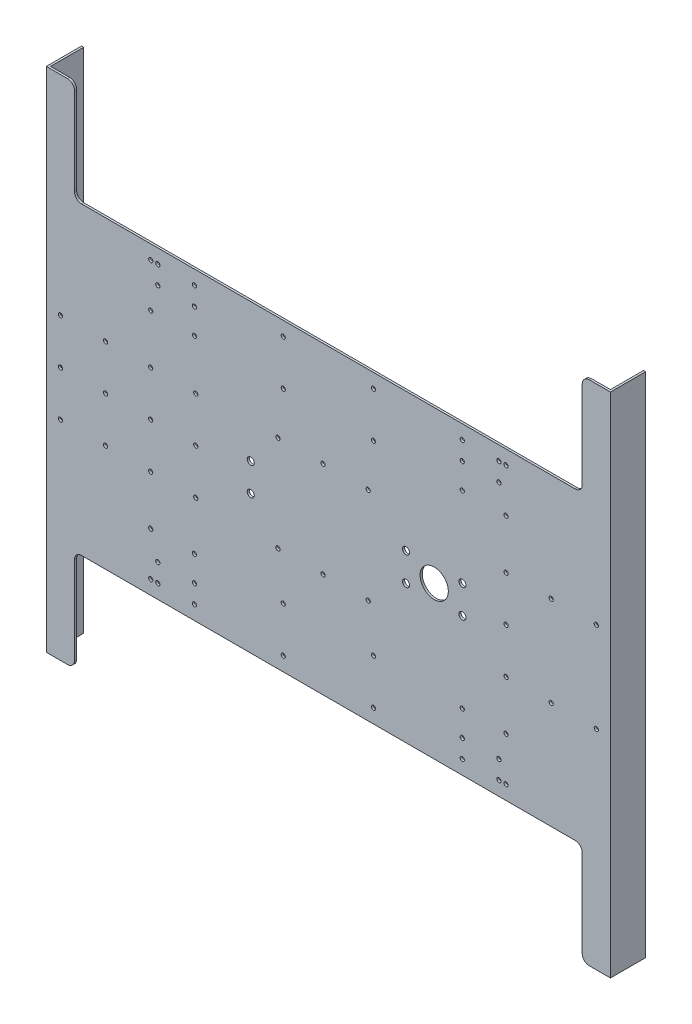
from build123d import *

# Parameters (mm, degrees)
SKETCH_1_R      = 1.49999994
SKETCH_1_R_2    = 9.999999603
SKETCH_1_R_3    = 2.499999901
EXTRUDE_1_DEPTH = 1.5
SKETCH_2_W      = 1.5
SKETCH_2_H      = 360
EXTRUDE_2_DEPTH = 25


with BuildPart() as part:
    # 草图1 → 凸台-拉伸1 (new body)
    with BuildSketch(Plane.XY):
        with BuildLine():
            Line((124.999995033, 180), (124.999995033, -180))
            Line((124.999995033, -180), (123.499999503, -180))
            Line((123.499999503, -180), (109.999999801, -180))
            ThreePointArc((109.999999801, -180), (106.464466036, -178.535533964), (105, -175.000000199))
            Line((105, -175.000000199), (105, -112.999998311))
            ThreePointArc((105, -112.999998311), (103.535533964, -109.464464546), (100.000000199, -107.99999851))
            Line((100.000000199, -107.99999851), (-250.16001102, -107.99999851))
            ThreePointArc((-250.16001102, -107.99999851), (-253.695544785, -109.464464546), (-255.160010821, -112.999998311))
            Line((-255.160010821, -112.999998311), (-255.160010821, -167.500000497))
            Line((-255.160010821, -167.500000497), (-255.160010821, -175.000000199))
            ThreePointArc((-255.160010821, -175.000000199), (-256.624476857, -178.535533964), (-260.160010622, -180))
            Line((-260.160010622, -180), (-273.660010324, -180))
            Line((-273.660010324, -180), (-275.160005854, -180))
            Line((-275.160005854, -180), (-275.160005854, 180))
            Line((-275.160005854, 180), (-273.660010324, 180))
            Line((-273.660010324, 180), (-260.160010622, 180))
            ThreePointArc((-260.160010622, 180), (-256.624476857, 178.535533964), (-255.160010821, 175.000000199))
            Line((-255.160010821, 175.000000199), (-255.160010821, 112.999998311))
            ThreePointArc((-255.160010821, 112.999998311), (-253.695544785, 109.464464546), (-250.16001102, 107.99999851))
            Line((-250.16001102, 107.99999851), (100.000000199, 107.99999851))
            ThreePointArc((100.000000199, 107.99999851), (103.535533964, 109.464464546), (105, 112.999998311))
            Line((105, 112.999998311), (105, 175.000000199))
            ThreePointArc((105, 175.000000199), (106.464466036, 178.535533964), (109.999999801, 180))
            Line((109.999999801, 180), (123.499999503, 180))
            Line((123.499999503, 180), (124.999995033, 180))
        make_face()
        with Locations((-201.080000404, 97.999998907)):
            Circle(SKETCH_1_R, mode=Mode.SUBTRACT)
        with Locations((-170.080001635, 97.999998907)):
            Circle(SKETCH_1_R, mode=Mode.SUBTRACT)
        Circle(SKETCH_1_R_2, mode=Mode.SUBTRACT)
        with Locations((114.99999543, 31.999998728)):
            Circle(SKETCH_1_R, mode=Mode.SUBTRACT)
        with Locations((82.999996702, 31.999998728)):
            Circle(SKETCH_1_R, mode=Mode.SUBTRACT)
        with Locations((19.919990815, 97.999998907)):
            Circle(SKETCH_1_R, mode=Mode.SUBTRACT)
        with Locations((50.919989583, 97.999998907)):
            Circle(SKETCH_1_R, mode=Mode.SUBTRACT)
        with Locations((19.919990815, 67.000000139)):
            Circle(SKETCH_1_R, mode=Mode.SUBTRACT)
        with Locations((50.919989583, 67.000000139)):
            Circle(SKETCH_1_R, mode=Mode.SUBTRACT)
        with Locations((-201.080000404, -97.999998907)):
            Circle(SKETCH_1_R, mode=Mode.SUBTRACT)
        with Locations((-170.080001635, -97.999998907)):
            Circle(SKETCH_1_R, mode=Mode.SUBTRACT)
        with Locations((19.919990815, -97.999998907)):
            Circle(SKETCH_1_R, mode=Mode.SUBTRACT)
        with Locations((50.919989583, -97.999998907)):
            Circle(SKETCH_1_R, mode=Mode.SUBTRACT)
        with Locations((114.99999543, -31.999998728)):
            Circle(SKETCH_1_R, mode=Mode.SUBTRACT)
        with Locations((82.999996702, -31.999998728)):
            Circle(SKETCH_1_R, mode=Mode.SUBTRACT)
        with Locations((-107.080004139, 97.999998907)):
            Circle(SKETCH_1_R, mode=Mode.SUBTRACT)
        with Locations((-107.080004139, 66.000000179)):
            Circle(SKETCH_1_R, mode=Mode.SUBTRACT)
        with Locations((-43.080006682, 97.999998907)):
            Circle(SKETCH_1_R, mode=Mode.SUBTRACT)
        with Locations((-43.080006682, 66.000000179)):
            Circle(SKETCH_1_R, mode=Mode.SUBTRACT)
        with Locations((-107.080004139, -97.999998907)):
            Circle(SKETCH_1_R, mode=Mode.SUBTRACT)
        with Locations((-107.080004139, -66.000000179)):
            Circle(SKETCH_1_R, mode=Mode.SUBTRACT)
        with Locations((-43.080006682, -97.999998907)):
            Circle(SKETCH_1_R, mode=Mode.SUBTRACT)
        with Locations((-43.080006682, -66.000000179)):
            Circle(SKETCH_1_R, mode=Mode.SUBTRACT)
        with Locations((-201.080000404, 67.000000139)):
            Circle(SKETCH_1_R, mode=Mode.SUBTRACT)
        with Locations((-170.080001635, 67.000000139)):
            Circle(SKETCH_1_R, mode=Mode.SUBTRACT)
        with Locations((-201.080000404, -67.000000139)):
            Circle(SKETCH_1_R, mode=Mode.SUBTRACT)
        with Locations((-170.080001635, -67.000000139)):
            Circle(SKETCH_1_R, mode=Mode.SUBTRACT)
        with Locations((19.919990815, -67.000000139)):
            Circle(SKETCH_1_R, mode=Mode.SUBTRACT)
        with Locations((50.919989583, -67.000000139)):
            Circle(SKETCH_1_R, mode=Mode.SUBTRACT)
        with Locations((-196.080000602, 97.999998907)):
            Circle(SKETCH_1_R, mode=Mode.SUBTRACT)
        with Locations((-196.080000602, 84.999999424)):
            Circle(SKETCH_1_R, mode=Mode.SUBTRACT)
        with Locations((-170.080001635, 84.999999424)):
            Circle(SKETCH_1_R, mode=Mode.SUBTRACT)
        with Locations((45.919989781, 97.999998907)):
            Circle(SKETCH_1_R, mode=Mode.SUBTRACT)
        with Locations((19.919990815, 84.999999424)):
            Circle(SKETCH_1_R, mode=Mode.SUBTRACT)
        with Locations((45.919989781, 84.999999424)):
            Circle(SKETCH_1_R, mode=Mode.SUBTRACT)
        with Locations((-196.080000602, -97.999998907)):
            Circle(SKETCH_1_R, mode=Mode.SUBTRACT)
        with Locations((-196.080000602, -84.999999424)):
            Circle(SKETCH_1_R, mode=Mode.SUBTRACT)
        with Locations((-170.080001635, -84.999999424)):
            Circle(SKETCH_1_R, mode=Mode.SUBTRACT)
        with Locations((45.919989781, -97.999998907)):
            Circle(SKETCH_1_R, mode=Mode.SUBTRACT)
        with Locations((19.919990815, -84.999999424)):
            Circle(SKETCH_1_R, mode=Mode.SUBTRACT)
        with Locations((45.919989781, -84.999999424)):
            Circle(SKETCH_1_R, mode=Mode.SUBTRACT)
        with Locations((-19.999999205, 9.999999603)):
            Circle(SKETCH_1_R_3, mode=Mode.SUBTRACT)
        with Locations((-19.999999205, -9.999999603)):
            Circle(SKETCH_1_R_3, mode=Mode.SUBTRACT)
        with Locations((19.999999205, 9.999999603)):
            Circle(SKETCH_1_R_3, mode=Mode.SUBTRACT)
        with Locations((19.999999205, -9.999999603)):
            Circle(SKETCH_1_R_3, mode=Mode.SUBTRACT)
        with Locations((-265.160006251, 31.999998728)):
            Circle(SKETCH_1_R, mode=Mode.SUBTRACT)
        with Locations((-233.160007523, 31.999998728)):
            Circle(SKETCH_1_R, mode=Mode.SUBTRACT)
        with Locations((-201.160008794, 31.999998728)):
            Circle(SKETCH_1_R, mode=Mode.SUBTRACT)
        with Locations((-201.160008794, 0)):
            Circle(SKETCH_1_R, mode=Mode.SUBTRACT)
        with Locations((-265.160006251, -31.999998728)):
            Circle(SKETCH_1_R, mode=Mode.SUBTRACT)
        with Locations((-233.160007523, -31.999998728)):
            Circle(SKETCH_1_R, mode=Mode.SUBTRACT)
        with Locations((-201.160008794, -31.999998728)):
            Circle(SKETCH_1_R, mode=Mode.SUBTRACT)
        with Locations((-130.160011616, 9.999999603)):
            Circle(SKETCH_1_R_3, mode=Mode.SUBTRACT)
        with Locations((-130.160011616, -9.999999603)):
            Circle(SKETCH_1_R_3, mode=Mode.SUBTRACT)
        with Locations((-169.160010066, 31.999998728)):
            Circle(SKETCH_1_R, mode=Mode.SUBTRACT)
        with Locations((-169.160010066, 0)):
            Circle(SKETCH_1_R, mode=Mode.SUBTRACT)
        with Locations((-169.160010066, -31.999998728)):
            Circle(SKETCH_1_R, mode=Mode.SUBTRACT)
        with Locations((-265.160006251, 0)):
            Circle(SKETCH_1_R, mode=Mode.SUBTRACT)
        with Locations((-233.160007523, 0)):
            Circle(SKETCH_1_R, mode=Mode.SUBTRACT)
        with Locations((50.999997973, 31.999998728)):
            Circle(SKETCH_1_R, mode=Mode.SUBTRACT)
        with Locations((50.999997973, 0)):
            Circle(SKETCH_1_R, mode=Mode.SUBTRACT)
        with Locations((50.999997973, -31.999998728)):
            Circle(SKETCH_1_R, mode=Mode.SUBTRACT)
        with Locations((-110.83000399, 34.00000145)):
            Circle(SKETCH_1_R, mode=Mode.SUBTRACT)
        with Locations((-78.830005261, 34.00000145)):
            Circle(SKETCH_1_R, mode=Mode.SUBTRACT)
        with Locations((-46.830006533, 34.00000145)):
            Circle(SKETCH_1_R, mode=Mode.SUBTRACT)
        with Locations((-110.83000399, -34.00000145)):
            Circle(SKETCH_1_R, mode=Mode.SUBTRACT)
        with Locations((-78.830005261, -34.00000145)):
            Circle(SKETCH_1_R, mode=Mode.SUBTRACT)
        with Locations((-46.830006533, -34.00000145)):
            Circle(SKETCH_1_R, mode=Mode.SUBTRACT)
    extrude(amount=EXTRUDE_1_DEPTH)

    # 草图2 → 凸台-拉伸2 (add)
    with BuildSketch(Plane.XY.offset(1.5)):
        with Locations((124.249995033, 0)):
            Rectangle(SKETCH_2_W, SKETCH_2_H)
        with Locations((-274.410005854, 0)):
            Rectangle(SKETCH_2_W, SKETCH_2_H)
    extrude(amount=-EXTRUDE_2_DEPTH)


solid = part.part
